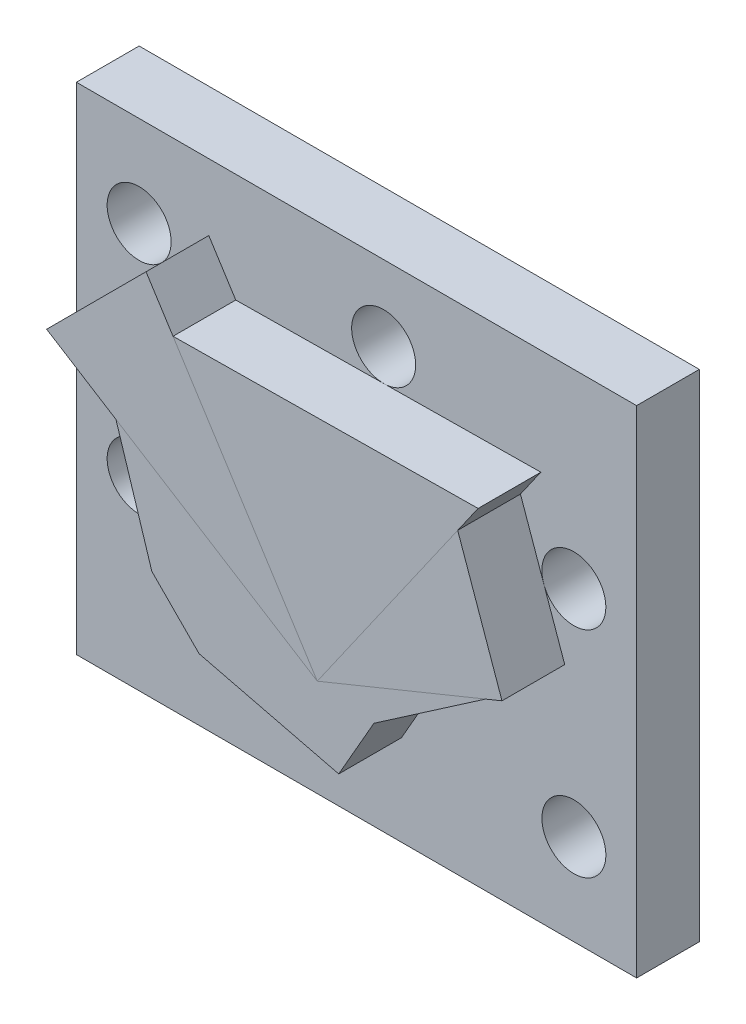
from build123d import *

# Parameters (mm, degrees)
SKETCH1_R      = 5.1
ADAPT_DEPTH    = 10
BASE_TRI_DEPTH = 10
TRIA_A_DEPTH   = 10
TRIA_B_DEPTH   = 10
TRIA_C_DEPTH   = 10


with BuildPart() as part:
    # Sketch1 → Adapt (new body)
    with BuildSketch(Plane.XY):
        Polygon((-48.965905952, -67.003827635), (40.316126078, -66.996848886), (40.309951027, 12.003150872), (-48.972081003, 11.996172124), align=None)
        Circle(SKETCH1_R, mode=Mode.SUBTRACT)
        with Locations((30.312256931, -18.266077562)):
            Circle(SKETCH1_R, mode=Mode.SUBTRACT)
        with Locations((30.314992713, -52.497630583)):
            Circle(SKETCH1_R, mode=Mode.SUBTRACT)
        with Locations((-8.655954925, -55.000676762)):
            Circle(SKETCH1_R, mode=Mode.SUBTRACT)
        with Locations((-38.968211856, -37.503046073)):
            Circle(SKETCH1_R, mode=Mode.SUBTRACT)
        with Locations((-38.970947638, -2.50304618)):
            Circle(SKETCH1_R, mode=Mode.SUBTRACT)
    extrude(amount=-ADAPT_DEPTH)


with BuildPart() as body_2:
    # Sketch4 → Base-Tri (new body)
    with BuildSketch(Plane.XY):
        Polygon((-26.947825639, -39.506627222), (-19.410569028, -47.106747776), (2.836271948, -52.572492472), (8.446713864, -42.772337787), (26.236702181, -30.538171837), (-0.582015344, -41.475658592), (-32.667971796, -21.385056531), align=None)
    extrude(amount=BASE_TRI_DEPTH)


with BuildPart() as body_3:
    # Sketch4<3> → Tria-A (new body)
    with BuildSketch(Plane.XY):
        Polygon((-43.716749587, -14.466871057), (-32.667971796, -21.385056531), (-0.582015344, -41.475658592), (-23.572585967, -5.367771104), (-27.873436509, 1.38693847), align=None)
    extrude(amount=TRIA_A_DEPTH)


with BuildPart() as body_4:
    # Sketch4<4> → Tria-B (new body)
    with BuildSketch(Plane.XY):
        Polygon((-23.572585967, -5.367771104), (-0.582015344, -41.475658592), (21.798844908, -9.46637083), (25.050295391, -4.816119991), align=None)
    extrude(amount=TRIA_B_DEPTH)


with BuildPart() as body_5:
    # Sketch4<5> → Tria-C (new body)
    with BuildSketch(Plane.XY):
        Polygon((-0.582015344, -41.475658592), (26.236702181, -30.538171837), (28.857404894, -29.469369751), (21.798844908, -9.46637083), align=None)
    extrude(amount=TRIA_C_DEPTH)


solid = Compound([part.part, body_2.part, body_3.part, body_4.part, body_5.part])
